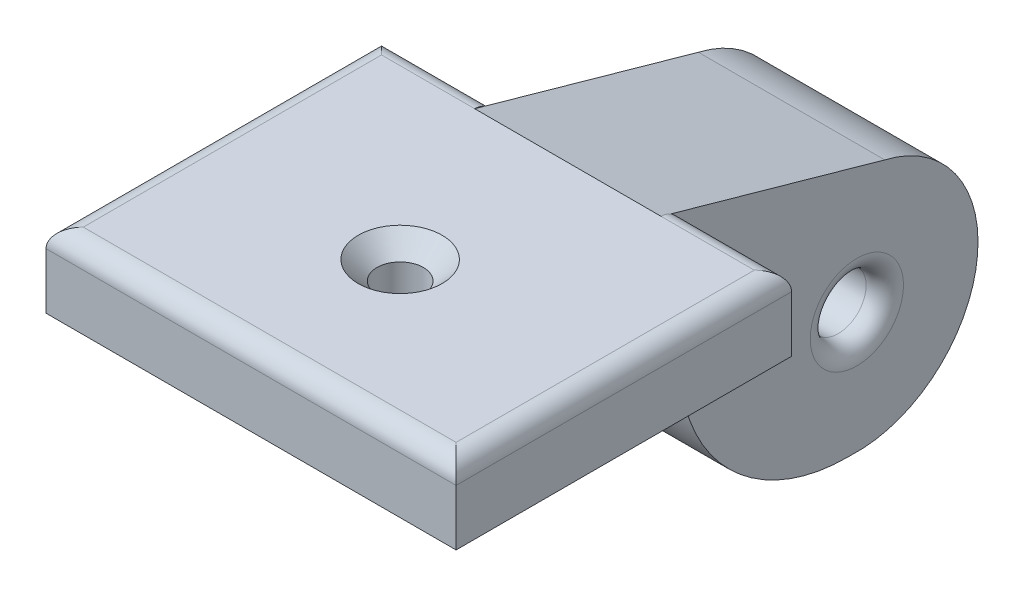
from build123d import *

# Parameters (mm, degrees)
SKETCH1_W           = 11
SKETCH1_H           = 18
SKETCH1_W_2         = 5
SKETCH1_H_2         = 11
BOSS_EXTRUDE1_DEPTH = 4
BOSS_EXTRUDE2_DEPTH = 5
SKETCH3_R           = 1.248430758
CUT_EXTRUDE1_DEPTH  = 5
FILLET1_R           = 1
FILLET3_R           = 2
FILLET4_R           = 9
CUT_EXTRUDE2_DEPTH  = 10
CHAMFER2_SIZE       = 1


with BuildPart() as part:
    # Sketch1 → Boss-Extrude1 (new body)
    with BuildSketch(Plane(origin=(0, 0, 0), x_dir=(1, 0, 0), z_dir=(0, 1, 0))):
        with Locations((-2.740875912, 16.357664234)):
            Rectangle(SKETCH1_W, SKETCH1_H)
        with Locations((-5.740875912, 30.857664234)):
            Rectangle(SKETCH1_W_2, SKETCH1_H_2)
    boss_extrude1 = extrude(amount=BOSS_EXTRUDE1_DEPTH)

    # Sketch2 → Boss-Extrude2 (add)
    with BuildSketch(Plane(origin=(-3.240875912, 0, 0), x_dir=(0, 0, -1), z_dir=(1, 0, 0))):
        with BuildLine():
            Line((34.537911903, 0), (25.357664234, 0))
            Line((25.357664234, 0), (25.357664234, -12.192130501))
            Line((25.357664234, -12.192130501), (34.537911903, -12.192130501))
            Line((34.537911903, -12.192130501), (34.537911903, -7.165523267))
            ThreePointArc((34.537911903, -7.165523267), (33.357664234, -5.7), (34.537911903, -4.234476733))
            Line((34.537911903, -4.234476733), (34.537911903, 0))
        make_face()
        with BuildLine():
            Line((36.357664234, 0), (34.537911903, 0))
            Line((34.537911903, 0), (34.537911903, -4.234476733))
            ThreePointArc((34.537911903, -4.234476733), (35.798507341, -4.531747353), (36.357664234, -5.7))
            ThreePointArc((36.357664234, -5.7), (35.798507341, -6.868252647), (34.537911903, -7.165523267))
            Line((34.537911903, -7.165523267), (34.537911903, -12.192130501))
            ThreePointArc((34.537911903, -12.192130501), (41.293121094, -6.613725887), (36.357664234, 0.62455532))
            Line((36.357664234, 0.62455532), (36.357664234, 0))
        make_face()
    boss_extrude2 = extrude(amount=-BOSS_EXTRUDE2_DEPTH)

    # Mirror1: Boss-Extrude1, Boss-Extrude2 across plane
    add(boss_extrude1.mirror(Plane(origin=(-8.240875912, 4, 0), x_dir=(0, 0, 1), z_dir=(1, 0, 0))))
    add(boss_extrude2.mirror(Plane(origin=(-8.240875912, 4, 0), x_dir=(0, 0, 1), z_dir=(1, 0, 0))))

    # Sketch3 → Cut-Extrude1 (cut)
    with BuildSketch(Plane(origin=(0, 4, 0), x_dir=(1, 0, 0), z_dir=(0, 1, 0))):
        with Locations(Location((-8.240875912, 15.357664234, 0), (0, 0, 270))):
            Circle(SKETCH3_R)
    extrude(amount=-CUT_EXTRUDE1_DEPTH, mode=Mode.SUBTRACT)

    # Fillet1
    fillet1_edges = [part.edges().sort_by_distance(p)[0] for p in [
        (-0.240875912, 4, -25.357664234),
        (-3.240875912, -4.234476733, -35.177416564),
        (-8.240875912, 4, -7.357664234),
        (-19.240875912, 4, -16.357664234),
        (-16.240875912, 4, -25.357664234),
        (2.759124088, 4, -16.357664234),
        (-13.240875912, -4.234476733, -35.177416564),
    ]]
    fillet(fillet1_edges, radius=FILLET1_R)

    # Fillet3
    fillet3_edges = [part.edges().sort_by_distance(p)[0] for p in [
        (-8.240875912, 0, -25.357664234),
    ]]
    fillet(fillet3_edges, radius=FILLET3_R)

    # Fillet4
    fillet4_edges = [part.edges().sort_by_distance(p)[0] for p in [
        (-8.240875912, -12.192130501, -25.357664234),
    ]]
    fillet(fillet4_edges, radius=FILLET4_R)

    # Sketch4 → Cut-Extrude2 (cut)
    with BuildSketch(Plane.ZY.offset(13.240875912)):
        Polygon((-36.357664234, 0.62455532), (-24.357664234, 4), (-36.357664234, 4), align=None)
    extrude(amount=-CUT_EXTRUDE2_DEPTH, mode=Mode.SUBTRACT)

    # Chamfer2
    chamfer2_edges = [part.edges().sort_by_distance(p)[0] for p in [
        (-8.240875912, 4, -16.606094992),
    ]]
    chamfer(chamfer2_edges, length=CHAMFER2_SIZE)


solid = part.part
